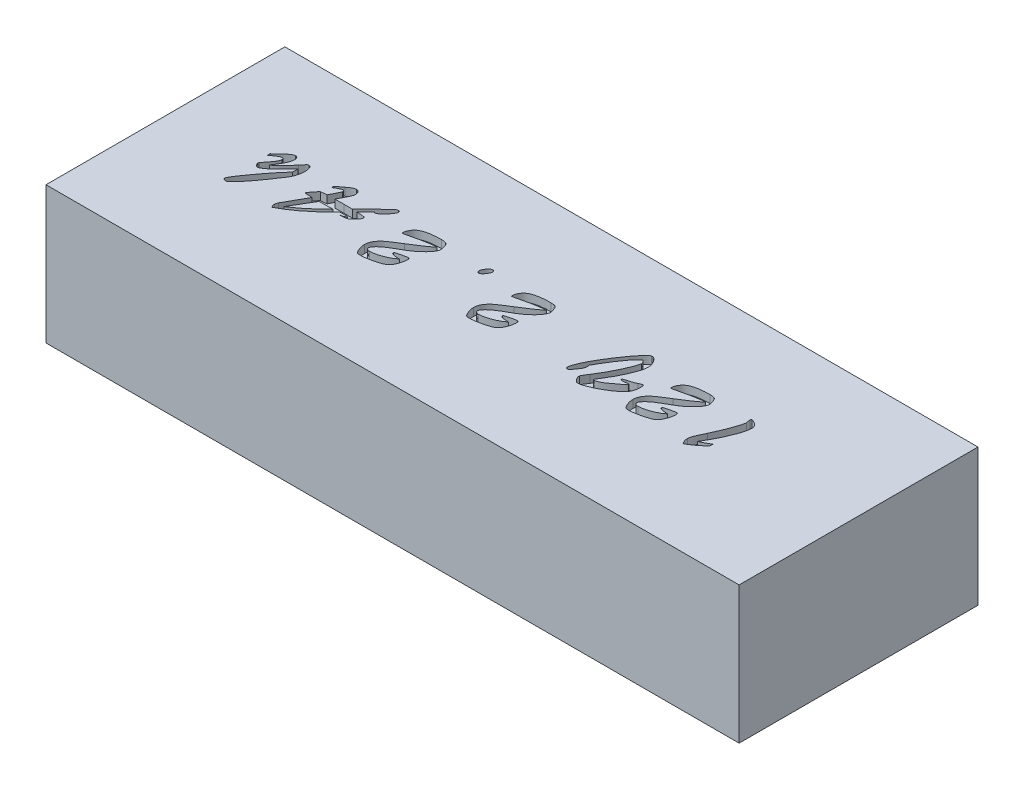
from build123d import *

# Parameters (mm, degrees)
SKETCH_15_W         = 177
SKETCH_15_H         = 35
EXTRUDE_1_DEPTH     = 61
CUT_EXTRUDE_1_DEPTH = 2


with BuildPart() as part:
    # 草图15 → 拉伸1 (new body)
    with BuildSketch(Plane.XY):
        Rectangle(SKETCH_15_W, SKETCH_15_H)
    extrude(amount=EXTRUDE_1_DEPTH)

    # 草图17 → 切除-拉伸1 (cut)
    # profile 1 of 8: a face of its own
    with BuildSketch(Plane(origin=(0, 17.5, 0), x_dir=(-1, 0, 0), z_dir=(0, 1, 0))):
        with BuildLine():
            Line((-54.027355029, 33.214724988), (-54.027355029, 34.105047569))
            add(Edge.make_bspline(
                [(-54.027355029, 34.105047569), (-53.849505071, 34.258497289), (-53.501007985, 34.559182095), (-52.978080495, 34.988064594), (-52.468469943, 35.388405433), (-51.972603012, 35.75987999), (-51.48890675, 36.099446051), (-51.015344563, 36.406167803), (-50.557627388, 36.687714872), (-50.250632295, 36.855719036), (-50.101548578, 36.937305634)],
                knots=[0, 0, 0, 0, 1.162118513, 2.277171826, 3.345656135, 4.368135439, 5.342192941, 6.268841697, 7.159310621, 8, 8, 8, 8], degree=3))
            add(Edge.make_bspline(
                [(-50.101548578, 36.937305634), (-50.012515981, 36.789926845), (-49.84260909, 36.508673993), (-49.662976636, 36.0726934), (-49.542027988, 35.654579686), (-49.527798138, 35.377843107), (-49.520903416, 35.243757247)],
                knots=[0, 0, 0, 0, 1.137868259, 2.171470516, 3.11403129, 4, 4, 4, 4], degree=3))
            add(Edge.make_bspline(
                [(-49.520903416, 35.243757247), (-49.522432163, 35.167272032), (-49.525634186, 35.00707062), (-49.565371778, 34.760680112), (-49.618556017, 34.49698058), (-49.688592109, 34.262433244), (-49.763992428, 34.043276629), (-49.849869671, 33.828397129), (-49.964049575, 33.564863251), (-50.100476312, 33.249340748), (-50.271513635, 32.887869879), (-50.463045217, 32.474583944), (-50.686894647, 32.014391993), (-50.844533349, 31.691054596), (-50.927355029, 31.521176601)],
                knots=[0, 0, 0, 0, 0.686216916, 1.437309403, 2.2365196, 3.101348091, 3.632713973, 4.317706836, 5.178645038, 6.212061466, 7.404462028, 8.769538373, 10.302750174, 12, 12, 12, 12], degree=3))
            add(Edge.make_bspline(
                [(-50.927355029, 31.521176601), (-51.121548909, 31.111688151), (-51.502339943, 30.308730147), (-52.01480083, 29.106687814), (-52.484259908, 27.94328985), (-52.820801114, 26.996163587), (-53.061094362, 26.284005263), (-53.210022809, 25.81169875), (-53.332077718, 25.397472013), (-53.430673824, 25.040915948), (-53.502914004, 24.740777134), (-53.548898557, 24.498035897), (-53.572110302, 24.310440779), (-53.560975985, 24.206109363), (-53.556387287, 24.163112085)],
                knots=[0, 0, 0, 0, 2.078851651, 4.076380107, 5.993559112, 7.833144257, 8.6864021, 9.441488966, 10.104852347, 10.667276435, 11.138686625, 11.519885961, 11.802134417, 12, 12, 12, 12], degree=3))
            add(Edge.make_bspline(
                [(-53.556387287, 24.163112085), (-53.533084238, 24.053567595), (-53.490467016, 23.853229784), (-53.442544015, 23.57997424), (-53.409670376, 23.362796627), (-53.403973279, 23.236302979), (-53.401548578, 23.182466924)],
                knots=[0, 0, 0, 0, 1.351825022, 2.472252726, 3.349786424, 4, 4, 4, 4], degree=3))
            add(Edge.make_bspline(
                [(-53.401548578, 23.182466924), (-53.402324505, 23.139065645), (-53.403736725, 23.060073534), (-53.439027743, 22.957164762), (-53.49657571, 22.879035836), (-53.551567068, 22.857642724), (-53.578967933, 22.846983053)],
                knots=[0, 0, 0, 0, 1.264800636, 2.301989114, 3.153922197, 4, 4, 4, 4], degree=3))
            add(Edge.make_bspline(
                [(-53.578967933, 22.846983053), (-53.653718273, 22.85507716), (-53.822383181, 22.873340511), (-54.092727034, 22.972709952), (-54.40338945, 23.132249052), (-54.687880212, 23.297150227), (-54.918028106, 23.460920588), (-55.072810884, 23.602841707), (-55.20561791, 23.756749698), (-55.310606247, 23.925227317), (-55.397996099, 24.104785018), (-55.453534809, 24.299237277), (-55.490870685, 24.504702246), (-55.495799059, 24.645732369), (-55.498322771, 24.717950795)],
                knots=[0, 0, 0, 0, 0.923802181, 2.084445488, 3.518449097, 5.229548094, 6.130646126, 6.993424202, 7.811176285, 8.627209044, 9.433284533, 10.263289462, 11.110668715, 12, 12, 12, 12], degree=3))
            add(Edge.make_bspline(
                [(-55.498322771, 24.717950795), (-55.49364736, 24.844954846), (-55.483749625, 25.113819414), (-55.430160528, 25.537761712), (-55.336487416, 26.004323779), (-55.211483338, 26.514770536), (-55.04681658, 27.069052077), (-54.851719776, 27.668176258), (-54.613367256, 28.308592733), (-54.25516814, 29.227343603), (-53.745265946, 30.401540293), (-53.051428511, 31.805212873), (-52.290353889, 33.205440409), (-51.725398639, 34.116294971), (-51.440258255, 34.576015311)],
                knots=[0, 0, 0, 0, 0.425399936, 0.900561592, 1.428734165, 2.018172412, 2.659625668, 3.36440062, 4.127573485, 4.947279051, 6.666251017, 8.411703564, 10.188939347, 12, 12, 12, 12], degree=3))
            add(Edge.make_bspline(
                [(-51.440258255, 34.576015311), (-51.648828171, 34.487973564), (-52.075423087, 34.307898879), (-52.712918252, 33.986149362), (-53.369663505, 33.624688311), (-53.804929892, 33.353370759), (-54.027355029, 33.214724988)],
                knots=[0, 0, 0, 0, 0.927840517, 1.897742753, 2.925727165, 4, 4, 4, 4], degree=3))
        make_face()
    # profile 2 of 8: a face of its own
    with BuildSketch(Plane(origin=(0, 17.5, 0), x_dir=(-1, 0, 0), z_dir=(0, 1, 0))):
        with BuildLine():
            add(Edge.make_bspline(
                [(-41.549935674, 32.298595956), (-41.383256519, 32.292837916), (-41.072263982, 32.282094475), (-40.640167156, 32.25709267), (-40.276658243, 32.209993115), (-39.978330321, 32.160777794), (-39.742990882, 32.089270605), (-39.569524581, 31.994905263), (-39.452457631, 31.865489355), (-39.439894089, 31.761759625), (-39.433806642, 31.711499182)],
                knots=[0, 0, 0, 0, 1.712128158, 3.194515118, 4.440360501, 5.473021791, 6.2967938, 6.949887491, 7.491186178, 8, 8, 8, 8], degree=3))
            add(Edge.make_bspline(
                [(-39.433806642, 31.711499182), (-39.437450279, 31.687229493), (-39.444946323, 31.637299519), (-39.493402323, 31.568079797), (-39.569407057, 31.508028089), (-39.657159489, 31.465593986), (-39.751878918, 31.434528313), (-39.85374496, 31.401348398), (-39.984292858, 31.362036192), (-40.147298961, 31.326757767), (-40.336349295, 31.275387098), (-40.556514162, 31.22599757), (-40.804275126, 31.166303518), (-41.072635305, 31.108802094), (-41.339853715, 31.048338704), (-41.587255952, 30.997033423), (-41.804675705, 30.95503541), (-41.990845971, 30.920458126), (-42.146232617, 30.889229021), (-42.272437089, 30.871459874), (-42.36785444, 30.85592558), (-42.421945669, 30.854144048), (-42.443484062, 30.853434666)],
                knots=[0, 0, 0, 0, 0.454144975, 0.934311362, 1.534835716, 2.25501497, 2.745203301, 3.40088538, 4.260823213, 5.295885172, 6.521314667, 7.927509613, 9.519277857, 11.292170825, 13.065063794, 14.648153313, 16.021990805, 17.210320673, 18.193380193, 18.987671717, 19.596904632, 20, 20, 20, 20], degree=3))
            add(Edge.make_bspline(
                [(-42.443484062, 30.853434666), (-42.49805028, 30.858975844), (-42.606685418, 30.8700077), (-42.725051578, 31.008128411), (-42.790940739, 31.202118443), (-42.795633266, 31.353670129), (-42.798322771, 31.44053144)],
                knots=[0, 0, 0, 0, 0.827101758, 1.646665563, 2.651194709, 4, 4, 4, 4], degree=3))
            add(Edge.make_bspline(
                [(-42.798322771, 31.44053144), (-42.795327725, 31.530944956), (-42.788997398, 31.722042835), (-42.751539335, 32.020466479), (-42.69210176, 32.34533903), (-42.585883029, 32.810985709), (-42.402638181, 33.393893914), (-42.162338146, 33.950831452), (-41.939238597, 34.356668832), (-41.766307951, 34.622419808), (-41.585526635, 34.847964349), (-41.384325992, 35.043256689), (-41.127509193, 35.209649907), (-40.803652223, 35.376072169), (-40.393292626, 35.541327706), (-39.730947105, 35.767533568), (-38.825807184, 36.025824814), (-37.891456327, 36.226452874), (-37.154493953, 36.350387752), (-36.644813275, 36.419887053), (-36.18287042, 36.460696668), (-35.890863674, 36.466722218), (-35.753161481, 36.469563698)],
                knots=[0, 0, 0, 0, 0.552948533, 1.168711237, 1.836805253, 2.572119188, 4.088157425, 5.566292137, 6.272636508, 6.918219531, 7.502531326, 8.037396291, 8.624623482, 9.36573545, 10.262000454, 11.326666401, 13.645136776, 16.012964412, 17.166357467, 18.214386186, 19.157954599, 20, 20, 20, 20], degree=3))
            add(Edge.make_bspline(
                [(-35.753161481, 36.469563698), (-35.673556577, 36.468525151), (-35.523756813, 36.466570822), (-35.316663127, 36.447490354), (-35.14159779, 36.419186927), (-35.012038685, 36.384592283), (-34.920804349, 36.329246602), (-34.849382436, 36.265745623), (-34.773596665, 36.178396657), (-34.69122091, 36.067087656), (-34.610402837, 35.92760861), (-34.51889219, 35.765871808), (-34.423164582, 35.579692017), (-34.290553209, 35.301965849), (-34.138980533, 34.937304487), (-34.011236062, 34.484769641), (-33.929099382, 34.028461585), (-33.919336424, 33.722595269), (-33.914451803, 33.569563698)],
                knots=[0, 0, 0, 0, 0.992300261, 1.867301351, 2.587913779, 3.206850752, 3.51949632, 3.909152152, 4.393389277, 4.959087463, 5.632658676, 6.400823473, 7.276132535, 8.241447597, 10.237783408, 12.189517989, 14.09353297, 16, 16, 16, 16], degree=3))
            add(Edge.make_bspline(
                [(-33.914451803, 33.569563698), (-33.921137022, 33.384959177), (-33.934226741, 33.023501869), (-34.059649656, 32.500168794), (-34.256166781, 32.008431781), (-34.539516612, 31.558751795), (-34.874945537, 31.141953244), (-35.242169218, 30.746473441), (-35.648325268, 30.38140862), (-36.015911209, 30.09734702), (-36.341079641, 29.875643364), (-36.612514889, 29.68818239), (-36.918229871, 29.489752485), (-37.248725336, 29.268198619), (-37.614091925, 29.03779805), (-38.008467532, 28.789665481), (-38.429655569, 28.520127094), (-38.723806461, 28.340015046), (-38.875742126, 28.246983053)],
                knots=[0, 0, 0, 0, 1.160088578, 2.271463839, 3.367318423, 4.47924987, 5.601696513, 6.731686741, 7.872045736, 9.034815783, 9.652440595, 10.348835808, 11.110893639, 11.946152371, 12.852921693, 13.829249471, 14.878757689, 16, 16, 16, 16], degree=3))
            add(Edge.make_bspline(
                [(-38.875742126, 28.246983053), (-39.060835978, 28.13216535), (-39.420854273, 27.908838249), (-39.941935515, 27.580193081), (-40.430616674, 27.270223766), (-40.884040148, 26.977202317), (-41.304905004, 26.702576602), (-41.692127156, 26.444655428), (-42.045683578, 26.203456106), (-42.366601454, 25.980444208), (-42.653811334, 25.774080863), (-42.907882751, 25.585117085), (-43.127376361, 25.412908398), (-43.317366575, 25.262457895), (-43.469402284, 25.124602771), (-43.592416526, 25.007746329), (-43.68165478, 24.907574037), (-43.72060702, 24.839995699), (-43.737032449, 24.811499182)],
                knots=[0, 0, 0, 0, 1.750353516, 3.404539268, 4.95068154, 6.400757937, 7.742882415, 8.989091186, 10.139500153, 11.182224826, 12.129458583, 12.981453384, 13.726427533, 14.371492799, 14.928345206, 15.374420061, 15.736204676, 16, 16, 16, 16], degree=3))
            add(Edge.make_bspline(
                [(-43.737032449, 24.811499182), (-43.645575974, 24.819548972), (-43.454864904, 24.836334924), (-43.157327934, 24.873915852), (-42.834413132, 24.914546397), (-42.488403434, 24.966954327), (-42.118597798, 25.025573764), (-41.724747473, 25.089448232), (-41.3064015, 25.163504197), (-40.727131357, 25.274873086), (-40.014712644, 25.412726691), (-39.198879506, 25.57830088), (-38.448237656, 25.748513724), (-37.864816969, 25.88163754), (-37.44506522, 25.989900774), (-37.175187852, 26.052272421), (-36.948184733, 26.112022704), (-36.760657245, 26.156576975), (-36.614281205, 26.191335722), (-36.508730974, 26.22024438), (-36.440965352, 26.230255023), (-36.410131604, 26.238293744), (-36.401548578, 26.24053144)],
                knots=[0, 0, 0, 0, 0.736432149, 1.53565688, 2.405493902, 3.347246641, 4.342768675, 5.409161659, 6.547928989, 7.750754798, 10.14109426, 12.369036871, 14.428288999, 16.315523824, 17.169084633, 17.905516782, 18.53732261, 19.051986577, 19.451575668, 19.744471653, 19.928869933, 20, 20, 20, 20], degree=3))
            add(Edge.make_bspline(
                [(-36.401548578, 26.24053144), (-36.370133502, 26.238688114), (-36.311283334, 26.235234994), (-36.241969056, 26.172741062), (-36.20303456, 26.082175919), (-36.20001124, 26.011988105), (-36.198322771, 25.972789505)],
                knots=[0, 0, 0, 0, 0.963027709, 1.80404922, 2.773601983, 4, 4, 4, 4], degree=3))
            add(Edge.make_bspline(
                [(-36.198322771, 25.972789505), (-36.205536897, 25.852672971), (-36.220693194, 25.6003178), (-36.341808519, 25.215501892), (-36.524235864, 24.80750768), (-36.730795068, 24.460212663), (-36.93433353, 24.179726793), (-37.123941595, 23.97968597), (-37.340163984, 23.791323288), (-37.588564131, 23.622299935), (-37.859138057, 23.458960765), (-38.160785416, 23.314227165), (-38.492104977, 23.187093564), (-38.848629467, 23.066697618), (-39.234832291, 22.964647141), (-39.648194513, 22.874787905), (-40.089235507, 22.796781834), (-40.560028897, 22.738202807), (-41.057556596, 22.683348705), (-41.58415108, 22.655766302), (-42.137853109, 22.629697001), (-42.516564369, 22.628330573), (-42.711225997, 22.627628214)],
                knots=[0, 0, 0, 0, 0.887452329, 1.86446592, 2.961484132, 4.192238212, 4.846236926, 5.521708883, 6.226755339, 6.963929466, 7.741675859, 8.56366018, 9.435351915, 10.366248975, 11.346658074, 12.389119003, 13.495702787, 14.659198309, 15.898945746, 17.198227383, 18.559858979, 20, 20, 20, 20], degree=3))
            add(Edge.make_bspline(
                [(-42.711225997, 22.627628214), (-42.820962188, 22.629351757), (-43.031175936, 22.632653424), (-43.332221104, 22.661153728), (-43.602916245, 22.709939443), (-43.85166677, 22.772201902), (-44.082732978, 22.895962602), (-44.266906019, 23.118121065), (-44.437649158, 23.407885231), (-44.565456384, 23.761296262), (-44.675389772, 24.11566443), (-44.753323682, 24.425509927), (-44.813396092, 24.663106486), (-44.823308112, 24.800546104), (-44.827355029, 24.856660472)],
                knots=[0, 0, 0, 0, 1.118255224, 2.142161307, 3.077240767, 3.920194592, 4.749359182, 5.695863099, 6.815996076, 8.169276886, 9.510748153, 10.597855967, 11.427527315, 12, 12, 12, 12], degree=3))
            add(Edge.make_bspline(
                [(-44.827355029, 24.856660472), (-44.82026855, 24.948766738), (-44.804750352, 25.150463965), (-44.693474035, 25.462650913), (-44.530175056, 25.811746916), (-44.299185564, 26.191246528), (-44.010537856, 26.599439913), (-43.656183483, 27.021722328), (-43.241614779, 27.455875857), (-42.773310157, 27.901667078), (-42.256048316, 28.34638132), (-41.694548291, 28.77441103), (-41.094852938, 29.183859625), (-40.673887633, 29.435185371), (-40.459613094, 29.563112085)],
                knots=[0, 0, 0, 0, 0.501938061, 1.099159917, 1.791816318, 2.604496272, 3.517377043, 4.516823598, 5.607864017, 6.790108059, 8.041986043, 9.326410419, 10.639122589, 12, 12, 12, 12], degree=3))
            Line((-40.459613094, 29.563112085), (-38.140258255, 30.901821763))
            add(Edge.make_bspline(
                [(-38.140258255, 30.901821763), (-38.058479816, 30.954419911), (-37.903453719, 31.054129392), (-37.683839919, 31.197332876), (-37.485886788, 31.322382365), (-37.312885899, 31.436064223), (-37.161435912, 31.531418581), (-37.035626525, 31.613739234), (-36.931632437, 31.676475234), (-36.82262989, 31.750633041), (-36.684488198, 31.841934858), (-36.517807029, 31.989183963), (-36.313873512, 32.15758158), (-36.100092769, 32.361599027), (-35.880040135, 32.569674613), (-35.688251267, 32.779418309), (-35.523707348, 32.973859394), (-35.391301611, 33.157383897), (-35.286838009, 33.328495616), (-35.210011105, 33.486324094), (-35.16602651, 33.632876357), (-35.157230167, 33.72633504), (-35.153161481, 33.769563698)],
                knots=[0, 0, 0, 0, 1.373843532, 2.604373499, 3.704363615, 4.682034968, 5.529166087, 6.232975601, 6.806293195, 7.244523026, 8.095867063, 9.14241321, 10.381634986, 11.832933368, 13.315622035, 14.659569981, 15.846172298, 16.912924958, 17.853535158, 18.675918084, 19.387555192, 20, 20, 20, 20], degree=3))
            add(Edge.make_bspline(
                [(-35.153161481, 33.769563698), (-35.156537494, 33.822868863), (-35.162948861, 33.92410041), (-35.22187941, 34.064499958), (-35.318251364, 34.182220757), (-35.501966206, 34.292155075), (-35.758035632, 34.396366354), (-35.978864158, 34.410783535), (-36.088645352, 34.417950795)],
                knots=[0, 0, 0, 0, 0.753891082, 1.431710418, 2.125848706, 2.875551902, 4.446733096, 6, 6, 6, 6], degree=3))
            add(Edge.make_bspline(
                [(-36.088645352, 34.417950795), (-36.182242982, 34.415721616), (-36.375131901, 34.411127656), (-36.673486147, 34.384293562), (-36.987974122, 34.339484129), (-37.317824951, 34.273038638), (-37.6636338, 34.193068555), (-38.025093163, 34.092497127), (-38.401968108, 33.971909062), (-38.921523256, 33.794416302), (-39.557857015, 33.539877255), (-40.277477432, 33.175489455), (-40.946002621, 32.770043631), (-41.350604416, 32.454199723), (-41.549935674, 32.298595956)],
                knots=[0, 0, 0, 0, 0.566287438, 1.167022835, 1.811003258, 2.487167056, 3.201968158, 3.957942266, 4.756200255, 5.59554555, 7.279483931, 8.897013492, 10.471281612, 12, 12, 12, 12], degree=3))
        make_face()
    # profile 3 of 8: a face of its own
    with BuildSketch(Plane(origin=(0, 17.5, 0), x_dir=(-1, 0, 0), z_dir=(0, 1, 0))):
        with BuildLine():
            add(Edge.make_bspline(
                [(-20.749935674, 31.608273376), (-20.774933565, 31.695875759), (-20.824600854, 31.86992936), (-20.832906895, 32.050729342), (-20.837032449, 32.14053144)],
                knots=[0, 0, 0, 0, 1.006613858, 2, 2, 2, 2], degree=3))
            add(Edge.make_bspline(
                [(-20.837032449, 32.14053144), (-20.834727342, 32.209562637), (-20.830039397, 32.349952854), (-20.784443518, 32.563171278), (-20.713496929, 32.781205403), (-20.611877604, 33.011735509), (-20.476348925, 33.263519735), (-20.299735488, 33.547449659), (-20.083392553, 33.870173961), (-19.876461046, 34.155004203), (-19.707797942, 34.390127737), (-19.583272411, 34.546152952), (-19.477965348, 34.68744965), (-19.38142209, 34.804209323), (-19.300628664, 34.90383671), (-19.229702967, 34.980427732), (-19.172230161, 35.039336554), (-19.092253403, 35.108644189), (-18.973842102, 35.175657278), (-18.86157121, 35.189002407), (-18.808000191, 35.19537015)],
                knots=[0, 0, 0, 0, 0.979192667, 1.991405004, 3.08276252, 4.231678255, 5.563769359, 7.140364566, 8.978429314, 11.080161825, 12.139976486, 13.08684521, 13.914534804, 14.641910604, 15.238226685, 15.7353848, 16.124097833, 16.405664382, 17.239249076, 18, 18, 18, 18], degree=3))
            add(Edge.make_bspline(
                [(-18.808000191, 35.19537015), (-18.748124393, 35.191674421), (-18.635093135, 35.184697765), (-18.494000604, 35.077859624), (-18.417809004, 34.907402934), (-18.411534293, 34.777955937), (-18.408000191, 34.705047569)],
                knots=[0, 0, 0, 0, 0.981323321, 1.852504923, 2.790467412, 4, 4, 4, 4], degree=3))
            add(Edge.make_bspline(
                [(-18.408000191, 34.705047569), (-18.410780979, 34.633931586), (-18.416887383, 34.477766182), (-18.462728818, 34.226495004), (-18.535132155, 33.939632152), (-18.632783382, 33.615509949), (-18.758950536, 33.255088854), (-18.915231603, 32.859094758), (-19.096157568, 32.425298126), (-19.305412215, 31.957724625), (-19.539180111, 31.456743989), (-19.808995684, 30.932848074), (-20.101873846, 30.381892109), (-20.420413804, 29.805817984), (-20.775633583, 29.21014199), (-21.150441318, 28.584201603), (-21.557550786, 27.936067708), (-21.987344341, 27.276607154), (-22.419540126, 26.621707644), (-22.840149851, 25.993444446), (-23.247132689, 25.405544769), (-23.638596642, 24.857616548), (-24.008318517, 24.344074418), (-24.361629131, 23.869633279), (-24.702695495, 23.437808779), (-25.018503299, 23.041272937), (-25.318460946, 22.689292492), (-25.59755832, 22.383084283), (-25.855092671, 22.123815978), (-26.091094794, 21.911516789), (-26.306684125, 21.745638613), (-26.499417825, 21.624338399), (-26.672910134, 21.543584929), (-26.785866225, 21.532602826), (-26.837032449, 21.527628214)],
                knots=[0, 0, 0, 0, 0.428542105, 0.941046549, 1.535232365, 2.211886391, 2.980526937, 3.836262313, 4.777528164, 5.813319729, 6.923739195, 8.109244249, 9.364685548, 10.684761649, 12.076418444, 13.54472893, 15.082242263, 16.689376438, 18.289214917, 19.811752002, 21.246420167, 22.598812254, 23.870608752, 25.060552293, 26.163894177, 27.187221478, 28.115862568, 28.950752001, 29.684012696, 30.317511851, 30.86324023, 31.320105263, 31.692025052, 32, 32, 32, 32], degree=3))
            add(Edge.make_bspline(
                [(-26.837032449, 21.527628214), (-26.891086248, 21.531122277), (-27.002030812, 21.538293787), (-27.166550813, 21.585774796), (-27.330741203, 21.660320998), (-27.48929118, 21.771462007), (-27.651763821, 21.906901134), (-27.811833864, 22.075434285), (-27.969621271, 22.274193025), (-28.178769108, 22.573148231), (-28.408246177, 22.977066915), (-28.605239155, 23.491554532), (-28.732200466, 24.020409276), (-28.746156919, 24.379608749), (-28.753161481, 24.559886279)],
                knots=[0, 0, 0, 0, 0.503812945, 1.034068056, 1.585876405, 2.178189513, 2.832896881, 3.556178244, 4.340664417, 5.197366464, 6.957109426, 8.655220357, 10.32129873, 12, 12, 12, 12], degree=3))
            add(Edge.make_bspline(
                [(-28.753161481, 24.559886279), (-28.749441785, 24.663240002), (-28.741546502, 24.882614667), (-28.693241312, 25.229750051), (-28.614906315, 25.614099742), (-28.50353196, 26.035401754), (-28.364576764, 26.495149592), (-28.1917204, 26.991200085), (-27.991844481, 27.527305401), (-27.761764055, 28.096859675), (-27.500788431, 28.688254211), (-27.220811765, 29.29729265), (-26.913944189, 29.913447801), (-26.587777482, 30.54252134), (-26.236199338, 31.178107853), (-25.864496693, 31.826389851), (-25.467859635, 32.482336386), (-25.192478249, 32.921554626), (-25.053161481, 33.143757247)],
                knots=[0, 0, 0, 0, 0.526360192, 1.117232038, 1.781935733, 2.522991214, 3.335378594, 4.227145286, 5.19740584, 6.248758313, 7.354564737, 8.488838769, 9.661784308, 10.859367023, 12.096938382, 13.360165343, 14.664494947, 16, 16, 16, 16], degree=3))
            add(Edge.make_bspline(
                [(-25.053161481, 33.143757247), (-25.008740749, 33.210203276), (-24.924854971, 33.335682453), (-24.811975492, 33.51537866), (-24.71962047, 33.675463373), (-24.636878042, 33.809533508), (-24.575364338, 33.924864125), (-24.533790171, 34.019070668), (-24.504848711, 34.089601921), (-24.497859248, 34.13072925), (-24.495096965, 34.146983053)],
                knots=[0, 0, 0, 0, 1.663907011, 3.142184467, 4.416771264, 5.510906452, 6.422128385, 7.133544335, 7.657570762, 8, 8, 8, 8], degree=3))
            add(Edge.make_bspline(
                [(-24.495096965, 34.146983053), (-24.497430672, 34.164188107), (-24.502324362, 34.200266402), (-24.555047259, 34.237669943), (-24.627648999, 34.258210239), (-24.685151123, 34.259280742), (-24.71767761, 34.259886279)],
                knots=[0, 0, 0, 0, 0.724523522, 1.51929627, 2.596772189, 4, 4, 4, 4], degree=3))
            add(Edge.make_bspline(
                [(-24.71767761, 34.259886279), (-24.806268992, 34.254019785), (-24.996830478, 34.241400864), (-25.298333108, 34.15883397), (-25.635618044, 34.033781766), (-25.93643027, 33.884418338), (-26.203785265, 33.745353569), (-26.425941408, 33.60945456), (-26.6715176, 33.460741862), (-26.932131459, 33.283140841), (-27.216867381, 33.091329343), (-27.518356804, 32.875189554), (-27.839409136, 32.637979731), (-28.170570198, 32.388442126), (-28.491859239, 32.1391181), (-28.791127144, 31.915774639), (-29.046837261, 31.710299283), (-29.27239127, 31.5376856), (-29.456613888, 31.384671439), (-29.611091532, 31.264619591), (-29.722371992, 31.163540421), (-29.822719176, 31.073667958), (-29.907674266, 30.984960366), (-29.981893831, 30.899881748), (-30.028569578, 30.835241022), (-30.041823723, 30.796681796), (-30.046709868, 30.782466924)],
                knots=[0, 0, 0, 0, 0.987500039, 2.124128434, 3.466642505, 4.994535316, 5.863152793, 6.8251561, 7.896191104, 9.06300514, 10.339588895, 11.72315468, 13.197454012, 14.78917246, 16.345016846, 17.730605882, 18.951097053, 20.001272777, 20.896041359, 21.620462375, 22.180853544, 22.571082182, 23.122036959, 23.547152053, 23.83305744, 24, 24, 24, 24], degree=3))
            add(Edge.make_bspline(
                [(-30.046709868, 30.782466924), (-30.044591286, 30.762191503), (-30.040439981, 30.722462367), (-29.994436826, 30.67671875), (-29.926641888, 30.6507268), (-29.873921626, 30.648353345), (-29.843484062, 30.646983053)],
                knots=[0, 0, 0, 0, 0.868675548, 1.70214619, 2.673354977, 4, 4, 4, 4], degree=3))
            add(Edge.make_bspline(
                [(-29.843484062, 30.646983053), (-29.830565592, 30.647921178), (-29.793826642, 30.650589118), (-29.722154372, 30.66240447), (-29.616380268, 30.673200695), (-29.534831713, 30.685294704), (-29.488645352, 30.692144343)],
                knots=[0, 0, 0, 0, 0.434309597, 1.235136924, 2.434074479, 4, 4, 4, 4], degree=3))
            add(Edge.make_bspline(
                [(-29.488645352, 30.692144343), (-29.372527085, 30.70513793), (-29.161882107, 30.728709018), (-28.877167295, 30.759347266), (-28.655493898, 30.776135225), (-28.528444731, 30.780610491), (-28.475742126, 30.782466924)],
                knots=[0, 0, 0, 0, 1.378356949, 2.500415968, 3.37794173, 4, 4, 4, 4], degree=3))
            add(Edge.make_bspline(
                [(-28.475742126, 30.782466924), (-28.406496585, 30.780559898), (-28.285915344, 30.777239085), (-28.132657107, 30.744272506), (-28.021191315, 30.675769561), (-28.007706107, 30.605071293), (-28.001548578, 30.572789505)],
                knots=[0, 0, 0, 0, 1.456761013, 2.536741669, 3.331856403, 4, 4, 4, 4], degree=3))
            add(Edge.make_bspline(
                [(-28.001548578, 30.572789505), (-28.00827059, 30.540034817), (-28.023603597, 30.465320904), (-28.111272955, 30.393749405), (-28.219861249, 30.337548315), (-28.359127283, 30.284936007), (-28.550154499, 30.225020701), (-28.694974273, 30.183206562), (-28.775742126, 30.159886279)],
                knots=[0, 0, 0, 0, 0.638861883, 1.45725314, 2.078550859, 3.051399703, 4.355527636, 6, 6, 6, 6], degree=3))
            add(Edge.make_bspline(
                [(-28.775742126, 30.159886279), (-28.93612726, 30.115317317), (-29.230578184, 30.033493199), (-29.630160157, 29.913626596), (-29.948884891, 29.814941957), (-30.273679761, 29.705925068), (-30.640586367, 29.54956655), (-30.922758363, 29.408792987), (-31.07251632, 29.334079827)],
                knots=[0, 0, 0, 0, 1.224786845, 2.248585069, 3.069349052, 3.679835758, 4.768612544, 6, 6, 6, 6], degree=3))
            add(Edge.make_bspline(
                [(-31.07251632, 29.334079827), (-31.131514735, 29.306880197), (-31.242573364, 29.255679608), (-31.401273041, 29.188256903), (-31.539268712, 29.131065406), (-31.654552764, 29.081663345), (-31.749543923, 29.045859896), (-31.82368159, 29.019921702), (-31.877341583, 29.002790376), (-31.906885631, 28.997355445), (-31.91767761, 28.99537015)],
                knots=[0, 0, 0, 0, 1.710105641, 3.219103224, 4.538594036, 5.642522965, 6.520461362, 7.209754339, 7.711335633, 8, 8, 8, 8], degree=3))
            add(Edge.make_bspline(
                [(-31.91767761, 28.99537015), (-31.948495008, 28.997044521), (-32.008649696, 29.000312847), (-32.086896836, 29.050371751), (-32.144074718, 29.127272028), (-32.181990357, 29.231261825), (-32.198708259, 29.359700532), (-32.221438189, 29.509733803), (-32.228404709, 29.682419976), (-32.229830774, 29.805059465), (-32.230580836, 29.869563698)],
                knots=[0, 0, 0, 0, 0.713025674, 1.391805893, 2.092695986, 2.930690766, 3.954385578, 5.123834635, 6.487234069, 8, 8, 8, 8], degree=3))
            add(Edge.make_bspline(
                [(-32.230580836, 29.869563698), (-32.228220127, 29.987869779), (-32.223623258, 30.218240291), (-32.202524763, 30.554453858), (-32.161055393, 30.872535297), (-32.098172248, 31.172363816), (-32.025618799, 31.456391206), (-31.936184902, 31.722697233), (-31.824940598, 31.96887691), (-31.696832534, 32.203794529), (-31.541639428, 32.433949069), (-31.353178531, 32.666366789), (-31.127412477, 32.905022289), (-30.870633556, 33.156360908), (-30.575860678, 33.415117239), (-30.242510592, 33.677116884), (-29.87758112, 33.95243554), (-29.343520412, 34.330661543), (-28.639608201, 34.789116588), (-27.762546011, 35.298075781), (-26.866198311, 35.772324971), (-26.102263953, 36.121764631), (-25.501802635, 36.376587575), (-25.082268363, 36.539140327), (-24.698418755, 36.685718715), (-24.343707231, 36.795241908), (-24.024689164, 36.890201896), (-23.736229293, 36.949531179), (-23.481333188, 36.992986642), (-23.321049037, 36.999022401), (-23.246709868, 37.001821763)],
                knots=[0, 0, 0, 0, 0.806487762, 1.570426456, 2.294958489, 2.990632914, 3.657248026, 4.292294887, 4.902495893, 5.496188657, 6.11413092, 6.791734823, 7.533266988, 8.352147475, 9.240164846, 10.205060856, 11.241379917, 12.355770817, 14.665039822, 16.964109984, 19.265456945, 21.574028039, 22.687478637, 23.710941487, 24.640798379, 25.486811797, 26.240842575, 26.907820185, 27.493451233, 28, 28, 28, 28], degree=3))
            add(Edge.make_bspline(
                [(-23.246709868, 37.001821763), (-23.170204153, 36.993464859), (-23.009392262, 36.975898987), (-22.775785012, 36.850008735), (-22.551142728, 36.649686972), (-22.334986458, 36.388580764), (-22.14220934, 36.094725583), (-21.99181697, 35.789770924), (-21.903840835, 35.480873219), (-21.891493517, 35.274372604), (-21.885419545, 35.172789505)],
                knots=[0, 0, 0, 0, 0.747912381, 1.572081296, 2.542977149, 3.68638631, 4.881022272, 5.978506002, 7.00557378, 8, 8, 8, 8], degree=3))
            add(Edge.make_bspline(
                [(-21.885419545, 35.172789505), (-21.890214829, 35.151097797), (-21.903348293, 35.091687901), (-21.953642071, 34.985731275), (-22.030744941, 34.838965762), (-22.138451925, 34.650610196), (-22.278097065, 34.422806072), (-22.445431854, 34.150876509), (-22.645353438, 33.839651725), (-22.789561018, 33.61892153), (-22.866064707, 33.501821763)],
                knots=[0, 0, 0, 0, 0.27392287, 0.750228147, 1.43962827, 2.326294518, 3.429213065, 4.74189267, 6.271538644, 8, 8, 8, 8], degree=3))
            add(Edge.make_bspline(
                [(-22.866064707, 33.501821763), (-22.984323285, 33.325084455), (-23.225874198, 32.964086896), (-23.574649321, 32.399684336), (-23.927753712, 31.807351129), (-24.281677157, 31.187429372), (-24.63338734, 30.535643468), (-24.988875427, 29.857375088), (-25.338761521, 29.14563941), (-25.686677374, 28.423806486), (-26.01250906, 27.71987723), (-26.300354057, 27.065195744), (-26.543584988, 26.475133433), (-26.741020925, 25.94887756), (-26.897124003, 25.487573595), (-27.012694665, 25.092672758), (-27.08341668, 24.760201364), (-27.095965902, 24.559048861), (-27.101548578, 24.469563698)],
                knots=[0, 0, 0, 0, 1.017273948, 2.077848845, 3.173571432, 4.316332412, 5.492562599, 6.716629042, 7.979638052, 9.28651311, 10.550119112, 11.690341612, 12.707719607, 13.603013993, 14.378967246, 15.036819279, 15.571517221, 16, 16, 16, 16], degree=3))
            add(Edge.make_bspline(
                [(-27.101548578, 24.469563698), (-27.094782414, 24.387637662), (-27.080908956, 24.219655111), (-26.958758857, 23.981020497), (-26.772680762, 23.754367305), (-26.610906852, 23.625686519), (-26.524129223, 23.556660472)],
                knots=[0, 0, 0, 0, 0.873508939, 1.79105774, 2.815094654, 4, 4, 4, 4], degree=3))
            add(Edge.make_bspline(
                [(-26.524129223, 23.556660472), (-26.431740223, 23.624217857), (-26.238387301, 23.765602845), (-25.954396224, 24.014331452), (-25.658769887, 24.302095728), (-25.349110942, 24.627470801), (-25.030615244, 24.994057795), (-24.69684895, 25.39660895), (-24.35742188, 25.844530863), (-23.997989266, 26.32519677), (-23.635126613, 26.850679061), (-23.25627344, 27.412173795), (-22.867609749, 28.015512677), (-22.463754162, 28.656469758), (-22.05199177, 29.338543883), (-21.624631589, 30.057496616), (-21.19066878, 30.819288784), (-20.89901647, 31.341394284), (-20.749935674, 31.608273376)],
                knots=[0, 0, 0, 0, 0.550960415, 1.153057254, 1.815885832, 2.537440211, 3.315376053, 4.154083036, 5.055147655, 6.021417934, 7.04419899, 8.129953246, 9.283307218, 10.500192941, 11.77811532, 13.119986147, 14.527854084, 16, 16, 16, 16], degree=3))
        make_face()
    # profile 4 of 8: a face of its own
    with BuildSketch(Plane(origin=(0, 17.5, 0), x_dir=(-1, 0, 0), z_dir=(0, 1, 0))):
        with BuildLine():
            add(Edge.make_bspline(
                [(-0.878967933, 32.298595956), (-0.712288778, 32.292837916), (-0.40129624, 32.282094475), (0.030800586, 32.25709267), (0.394309498, 32.209993115), (0.692637421, 32.160777794), (0.92797686, 32.089270605), (1.101443161, 31.994905263), (1.218510111, 31.865489355), (1.231073653, 31.761759625), (1.2371611, 31.711499182)],
                knots=[0, 0, 0, 0, 1.712128158, 3.194515118, 4.440360501, 5.473021791, 6.2967938, 6.949887491, 7.491186178, 8, 8, 8, 8], degree=3))
            add(Edge.make_bspline(
                [(1.2371611, 31.711499182), (1.233517463, 31.687229493), (1.226021419, 31.637299519), (1.177565419, 31.568079797), (1.101560685, 31.508028089), (1.013808253, 31.465593986), (0.919088824, 31.434528313), (0.817222781, 31.401348398), (0.686674884, 31.362036192), (0.52366878, 31.326757767), (0.334618447, 31.275387098), (0.11445358, 31.22599757), (-0.133307384, 31.166303518), (-0.401667563, 31.108802094), (-0.668885973, 31.048338704), (-0.91628821, 30.997033423), (-1.133707963, 30.95503541), (-1.319878229, 30.920458126), (-1.475264875, 30.889229021), (-1.601469347, 30.871459874), (-1.696886698, 30.85592558), (-1.750977927, 30.854144048), (-1.77251632, 30.853434666)],
                knots=[0, 0, 0, 0, 0.454144975, 0.934311362, 1.534835716, 2.25501497, 2.745203301, 3.40088538, 4.260823213, 5.295885172, 6.521314667, 7.927509613, 9.519277857, 11.292170825, 13.065063794, 14.648153313, 16.021990805, 17.210320673, 18.193380193, 18.987671717, 19.596904632, 20, 20, 20, 20], degree=3))
            add(Edge.make_bspline(
                [(-1.77251632, 30.853434666), (-1.827082538, 30.858975844), (-1.935717676, 30.8700077), (-2.054083836, 31.008128411), (-2.119972997, 31.202118443), (-2.124665524, 31.353670129), (-2.127355029, 31.44053144)],
                knots=[0, 0, 0, 0, 0.827101758, 1.646665563, 2.651194709, 4, 4, 4, 4], degree=3))
            add(Edge.make_bspline(
                [(-2.127355029, 31.44053144), (-2.124359983, 31.530944956), (-2.118029656, 31.722042835), (-2.080571593, 32.020466479), (-2.021134018, 32.34533903), (-1.914915287, 32.810985709), (-1.731670439, 33.393893914), (-1.491370405, 33.950831452), (-1.268270855, 34.356668832), (-1.095340209, 34.622419808), (-0.914558893, 34.847964349), (-0.71335825, 35.043256689), (-0.456541451, 35.209649907), (-0.132684481, 35.376072169), (0.277675116, 35.541327706), (0.940020637, 35.767533568), (1.845160558, 36.025824814), (2.779511415, 36.226452874), (3.516473789, 36.350387752), (4.026154467, 36.419887053), (4.488097321, 36.460696668), (4.780104068, 36.466722218), (4.917806261, 36.469563698)],
                knots=[0, 0, 0, 0, 0.552948533, 1.168711237, 1.836805253, 2.572119188, 4.088157425, 5.566292137, 6.272636508, 6.918219531, 7.502531326, 8.037396291, 8.624623482, 9.36573545, 10.262000454, 11.326666401, 13.645136776, 16.012964412, 17.166357467, 18.214386186, 19.157954599, 20, 20, 20, 20], degree=3))
            add(Edge.make_bspline(
                [(4.917806261, 36.469563698), (4.997411165, 36.468525151), (5.147210929, 36.466570822), (5.354304615, 36.447490354), (5.529369952, 36.419186927), (5.658929057, 36.384592283), (5.750163393, 36.329246602), (5.821585306, 36.265745623), (5.897371076, 36.178396657), (5.979746832, 36.067087656), (6.060564905, 35.92760861), (6.152075552, 35.765871808), (6.24780316, 35.579692017), (6.380414533, 35.301965849), (6.531987209, 34.937304487), (6.65973168, 34.484769641), (6.74186836, 34.028461585), (6.751631318, 33.722595269), (6.756515938, 33.569563698)],
                knots=[0, 0, 0, 0, 0.992300261, 1.867301351, 2.587913779, 3.206850752, 3.51949632, 3.909152152, 4.393389277, 4.959087463, 5.632658676, 6.400823473, 7.276132535, 8.241447597, 10.237783408, 12.189517989, 14.09353297, 16, 16, 16, 16], degree=3))
            add(Edge.make_bspline(
                [(6.756515938, 33.569563698), (6.74983072, 33.384959177), (6.736741001, 33.023501869), (6.611318086, 32.500168794), (6.414800961, 32.008431781), (6.13145113, 31.558751795), (5.796022205, 31.141953244), (5.428798524, 30.746473441), (5.022642474, 30.38140862), (4.655056533, 30.09734702), (4.329888101, 29.875643364), (4.058452853, 29.68818239), (3.752737871, 29.489752485), (3.422242406, 29.268198619), (3.056875817, 29.03779805), (2.66250021, 28.789665481), (2.241312173, 28.520127094), (1.947161281, 28.340015046), (1.795225616, 28.246983053)],
                knots=[0, 0, 0, 0, 1.160088578, 2.271463839, 3.367318423, 4.47924987, 5.601696513, 6.731686741, 7.872045736, 9.034815783, 9.652440595, 10.348835808, 11.110893639, 11.946152371, 12.852921693, 13.829249471, 14.878757689, 16, 16, 16, 16], degree=3))
            add(Edge.make_bspline(
                [(1.795225616, 28.246983053), (1.610131764, 28.13216535), (1.250113469, 27.908838249), (0.729032227, 27.580193081), (0.240351068, 27.270223766), (-0.213072406, 26.977202317), (-0.633937262, 26.702576602), (-1.021159414, 26.444655428), (-1.374715836, 26.203456106), (-1.695633712, 25.980444208), (-1.982843592, 25.774080863), (-2.236915009, 25.585117085), (-2.456408619, 25.412908398), (-2.646398833, 25.262457895), (-2.798434542, 25.124602771), (-2.921448784, 25.007746329), (-3.010687038, 24.907574037), (-3.049639278, 24.839995699), (-3.066064707, 24.811499182)],
                knots=[0, 0, 0, 0, 1.750353516, 3.404539268, 4.95068154, 6.400757937, 7.742882415, 8.989091186, 10.139500153, 11.182224826, 12.129458583, 12.981453384, 13.726427533, 14.371492799, 14.928345206, 15.374420061, 15.736204676, 16, 16, 16, 16], degree=3))
            add(Edge.make_bspline(
                [(-3.066064707, 24.811499182), (-2.974608233, 24.819548972), (-2.783897162, 24.836334924), (-2.486360193, 24.873915852), (-2.16344539, 24.914546397), (-1.817435692, 24.966954327), (-1.447630056, 25.025573764), (-1.053779731, 25.089448232), (-0.635433758, 25.163504197), (-0.056163616, 25.274873086), (0.656255097, 25.412726691), (1.472088236, 25.57830088), (2.222730086, 25.748513724), (2.806150773, 25.88163754), (3.225902521, 25.989900774), (3.49577989, 26.052272421), (3.722783009, 26.112022704), (3.910310497, 26.156576975), (4.056686537, 26.191335722), (4.162236768, 26.22024438), (4.23000239, 26.230255023), (4.260836138, 26.238293744), (4.269419164, 26.24053144)],
                knots=[0, 0, 0, 0, 0.736432149, 1.53565688, 2.405493902, 3.347246641, 4.342768675, 5.409161659, 6.547928989, 7.750754798, 10.14109426, 12.369036871, 14.428288999, 16.315523824, 17.169084633, 17.905516782, 18.53732261, 19.051986577, 19.451575668, 19.744471653, 19.928869933, 20, 20, 20, 20], degree=3))
            add(Edge.make_bspline(
                [(4.269419164, 26.24053144), (4.30083424, 26.238688114), (4.359684408, 26.235234994), (4.428998686, 26.172741062), (4.467933182, 26.082175919), (4.470956502, 26.011988105), (4.472644971, 25.972789505)],
                knots=[0, 0, 0, 0, 0.963027709, 1.80404922, 2.773601983, 4, 4, 4, 4], degree=3))
            add(Edge.make_bspline(
                [(4.472644971, 25.972789505), (4.465430845, 25.852672971), (4.450274548, 25.6003178), (4.329159223, 25.215501892), (4.146731878, 24.80750768), (3.940172674, 24.460212663), (3.736634212, 24.179726793), (3.547026147, 23.97968597), (3.330803758, 23.791323288), (3.08240361, 23.622299935), (2.811829685, 23.458960765), (2.510182326, 23.314227165), (2.178862765, 23.187093564), (1.822338275, 23.066697618), (1.436135451, 22.964647141), (1.022773229, 22.874787905), (0.581732235, 22.796781834), (0.110938845, 22.738202807), (-0.386588854, 22.683348705), (-0.913183338, 22.655766302), (-1.466885367, 22.629697001), (-1.845596627, 22.628330573), (-2.040258255, 22.627628214)],
                knots=[0, 0, 0, 0, 0.887452329, 1.86446592, 2.961484132, 4.192238212, 4.846236926, 5.521708883, 6.226755339, 6.963929466, 7.741675859, 8.56366018, 9.435351915, 10.366248975, 11.346658074, 12.389119003, 13.495702787, 14.659198309, 15.898945746, 17.198227383, 18.559858979, 20, 20, 20, 20], degree=3))
            add(Edge.make_bspline(
                [(-2.040258255, 22.627628214), (-2.149994446, 22.629351757), (-2.360208194, 22.632653424), (-2.661253362, 22.661153728), (-2.931948503, 22.709939443), (-3.180699028, 22.772201902), (-3.411765236, 22.895962602), (-3.595938277, 23.118121065), (-3.766681416, 23.407885231), (-3.894488642, 23.761296262), (-4.00442203, 24.11566443), (-4.08235594, 24.425509927), (-4.142428351, 24.663106486), (-4.15234037, 24.800546104), (-4.156387287, 24.856660472)],
                knots=[0, 0, 0, 0, 1.118255224, 2.142161307, 3.077240767, 3.920194592, 4.749359182, 5.695863099, 6.815996076, 8.169276886, 9.510748153, 10.597855967, 11.427527315, 12, 12, 12, 12], degree=3))
            add(Edge.make_bspline(
                [(-4.156387287, 24.856660472), (-4.149300808, 24.948766738), (-4.13378261, 25.150463965), (-4.022506293, 25.462650913), (-3.859207314, 25.811746916), (-3.628217822, 26.191246528), (-3.339570114, 26.599439913), (-2.985215741, 27.021722328), (-2.570647037, 27.455875857), (-2.102342415, 27.901667078), (-1.585080574, 28.34638132), (-1.023580549, 28.77441103), (-0.423885196, 29.183859625), (-0.002919891, 29.435185371), (0.211354648, 29.563112085)],
                knots=[0, 0, 0, 0, 0.501938061, 1.099159917, 1.791816318, 2.604496272, 3.517377043, 4.516823598, 5.607864017, 6.790108059, 8.041986043, 9.326410419, 10.639122589, 12, 12, 12, 12], degree=3))
            Line((0.211354648, 29.563112085), (2.530709487, 30.901821763))
            add(Edge.make_bspline(
                [(2.530709487, 30.901821763), (2.612487926, 30.954419911), (2.767514023, 31.054129392), (2.987127823, 31.197332876), (3.185080954, 31.322382365), (3.358081843, 31.436064223), (3.50953183, 31.531418581), (3.635341217, 31.613739234), (3.739335305, 31.676475234), (3.848337852, 31.750633041), (3.986479544, 31.841934858), (4.153160713, 31.989183963), (4.35709423, 32.15758158), (4.570874973, 32.361599027), (4.790927607, 32.569674613), (4.982716475, 32.779418309), (5.147260394, 32.973859394), (5.279666131, 33.157383897), (5.384129733, 33.328495616), (5.460956637, 33.486324094), (5.504941232, 33.632876357), (5.513737575, 33.72633504), (5.517806261, 33.769563698)],
                knots=[0, 0, 0, 0, 1.373843532, 2.604373499, 3.704363615, 4.682034968, 5.529166087, 6.232975601, 6.806293195, 7.244523026, 8.095867063, 9.14241321, 10.381634986, 11.832933368, 13.315622035, 14.659569981, 15.846172298, 16.912924958, 17.853535158, 18.675918084, 19.387555192, 20, 20, 20, 20], degree=3))
            add(Edge.make_bspline(
                [(5.517806261, 33.769563698), (5.514430248, 33.822868863), (5.50801888, 33.92410041), (5.449088332, 34.064499958), (5.352716378, 34.182220757), (5.169001536, 34.292155075), (4.912932109, 34.396366354), (4.692103583, 34.410783535), (4.58232239, 34.417950795)],
                knots=[0, 0, 0, 0, 0.753891082, 1.431710418, 2.125848706, 2.875551902, 4.446733096, 6, 6, 6, 6], degree=3))
            add(Edge.make_bspline(
                [(4.58232239, 34.417950795), (4.48872476, 34.415721616), (4.295835841, 34.411127656), (3.997481595, 34.384293562), (3.68299362, 34.339484129), (3.353142791, 34.273038638), (3.007333941, 34.193068555), (2.645874579, 34.092497127), (2.268999634, 33.971909062), (1.749444486, 33.794416302), (1.113110727, 33.539877255), (0.39349031, 33.175489455), (-0.275034879, 32.770043631), (-0.679636674, 32.454199723), (-0.878967933, 32.298595956)],
                knots=[0, 0, 0, 0, 0.566287438, 1.167022835, 1.811003258, 2.487167056, 3.201968158, 3.957942266, 4.756200255, 5.59554555, 7.279483931, 8.897013492, 10.471281612, 12, 12, 12, 12], degree=3))
        make_face()
    # profile 5 of 8: a face of its own
    with BuildSketch(Plane(origin=(0, 17.5, 0), x_dir=(-1, 0, 0), z_dir=(0, 1, 0))):
        with BuildLine():
            add(Edge.make_bspline(
                [(14.185548197, 24.717950795), (14.177647713, 24.624683328), (14.160785083, 24.425615172), (14.046590294, 24.120917967), (13.870592819, 23.794842292), (13.633320094, 23.468152314), (13.376830809, 23.167327956), (13.115025717, 22.937824125), (12.858504756, 22.789172957), (12.682694223, 22.766916631), (12.601677229, 22.756660472)],
                knots=[0, 0, 0, 0, 0.836036182, 1.784418376, 2.888802252, 4.1543613, 5.398019811, 6.424060003, 7.273775479, 8, 8, 8, 8], degree=3))
            add(Edge.make_bspline(
                [(12.601677229, 22.756660472), (12.543873195, 22.763487069), (12.424730999, 22.777557638), (12.27640244, 22.898981674), (12.170047004, 23.075623281), (12.161192567, 23.217309992), (12.156515938, 23.292144343)],
                knots=[0, 0, 0, 0, 0.887017935, 1.82826798, 2.852961171, 4, 4, 4, 4], degree=3))
            add(Edge.make_bspline(
                [(12.156515938, 23.292144343), (12.163482716, 23.374726172), (12.178959725, 23.5581854), (12.298391667, 23.843206895), (12.460181918, 24.174255928), (12.688032284, 24.518807917), (12.931805866, 24.849089839), (13.19231916, 25.098316316), (13.451321851, 25.265647982), (13.63315166, 25.288129312), (13.717806261, 25.298595956)],
                knots=[0, 0, 0, 0, 0.735930139, 1.634901727, 2.729742276, 4.02936617, 5.315981915, 6.382333645, 7.246862207, 8, 8, 8, 8], degree=3))
            add(Edge.make_bspline(
                [(13.717806261, 25.298595956), (13.787572298, 25.293520188), (13.919738974, 25.283904515), (14.086750296, 25.159352671), (14.175022963, 24.956802676), (14.181764718, 24.803810263), (14.185548197, 24.717950795)],
                knots=[0, 0, 0, 0, 0.973282803, 1.843813406, 2.789946307, 4, 4, 4, 4], degree=3))
        make_face()
    # profile 6 of 8: a face of its own
    with BuildSketch(Plane(origin=(0, 17.5, 0), x_dir=(-1, 0, 0), z_dir=(0, 1, 0))):
        with BuildLine():
            add(Edge.make_bspline(
                [(26.991999809, 32.298595956), (27.158678964, 32.292837916), (27.469671502, 32.282094475), (27.901768328, 32.25709267), (28.26527724, 32.209993115), (28.563605163, 32.160777794), (28.798944602, 32.089270605), (28.972410903, 31.994905263), (29.089477853, 31.865489355), (29.102041395, 31.761759625), (29.108128842, 31.711499182)],
                knots=[0, 0, 0, 0, 1.712128158, 3.194515118, 4.440360501, 5.473021791, 6.2967938, 6.949887491, 7.491186178, 8, 8, 8, 8], degree=3))
            add(Edge.make_bspline(
                [(29.108128842, 31.711499182), (29.104485205, 31.687229493), (29.096989161, 31.637299519), (29.048533161, 31.568079797), (28.972528427, 31.508028089), (28.884775995, 31.465593986), (28.790056566, 31.434528313), (28.688190523, 31.401348398), (28.557642626, 31.362036192), (28.394636522, 31.326757767), (28.205586189, 31.275387098), (27.985421322, 31.22599757), (27.737660358, 31.166303518), (27.469300179, 31.108802094), (27.202081769, 31.048338704), (26.954679531, 30.997033423), (26.737259779, 30.95503541), (26.551089513, 30.920458126), (26.395702867, 30.889229021), (26.269498395, 30.871459874), (26.174081044, 30.85592558), (26.119989815, 30.854144048), (26.098451422, 30.853434666)],
                knots=[0, 0, 0, 0, 0.454144975, 0.934311362, 1.534835716, 2.25501497, 2.745203301, 3.40088538, 4.260823213, 5.295885172, 6.521314667, 7.927509613, 9.519277857, 11.292170825, 13.065063794, 14.648153313, 16.021990805, 17.210320673, 18.193380193, 18.987671717, 19.596904632, 20, 20, 20, 20], degree=3))
            add(Edge.make_bspline(
                [(26.098451422, 30.853434666), (26.043885204, 30.858975844), (25.935250066, 30.8700077), (25.816883906, 31.008128411), (25.750994745, 31.202118443), (25.746302218, 31.353670129), (25.743612713, 31.44053144)],
                knots=[0, 0, 0, 0, 0.827101758, 1.646665563, 2.651194709, 4, 4, 4, 4], degree=3))
            add(Edge.make_bspline(
                [(25.743612713, 31.44053144), (25.746607759, 31.530944956), (25.752938085, 31.722042835), (25.790396149, 32.020466479), (25.849833724, 32.34533903), (25.956052455, 32.810985709), (26.139297303, 33.393893914), (26.379597337, 33.950831452), (26.602696887, 34.356668832), (26.775627532, 34.622419808), (26.956408849, 34.847964349), (27.157609492, 35.043256689), (27.414426291, 35.209649907), (27.738283261, 35.376072169), (28.148642858, 35.541327706), (28.810988379, 35.767533568), (29.7161283, 36.025824814), (30.650479157, 36.226452874), (31.387441531, 36.350387752), (31.897122209, 36.419887053), (32.359065063, 36.460696668), (32.65107181, 36.466722218), (32.788774003, 36.469563698)],
                knots=[0, 0, 0, 0, 0.552948533, 1.168711237, 1.836805253, 2.572119188, 4.088157425, 5.566292137, 6.272636508, 6.918219531, 7.502531326, 8.037396291, 8.624623482, 9.36573545, 10.262000454, 11.326666401, 13.645136776, 16.012964412, 17.166357467, 18.214386186, 19.157954599, 20, 20, 20, 20], degree=3))
            add(Edge.make_bspline(
                [(32.788774003, 36.469563698), (32.868378907, 36.468525151), (33.018178671, 36.466570822), (33.225272356, 36.447490354), (33.400337694, 36.419186927), (33.529896799, 36.384592283), (33.621131135, 36.329246602), (33.692553048, 36.265745623), (33.768338818, 36.178396657), (33.850714574, 36.067087656), (33.931532647, 35.92760861), (34.023043294, 35.765871808), (34.118770902, 35.579692017), (34.251382275, 35.301965849), (34.402954951, 34.937304487), (34.530699422, 34.484769641), (34.612836102, 34.028461585), (34.62259906, 33.722595269), (34.62748368, 33.569563698)],
                knots=[0, 0, 0, 0, 0.992300261, 1.867301351, 2.587913779, 3.206850752, 3.51949632, 3.909152152, 4.393389277, 4.959087463, 5.632658676, 6.400823473, 7.276132535, 8.241447597, 10.237783408, 12.189517989, 14.09353297, 16, 16, 16, 16], degree=3))
            add(Edge.make_bspline(
                [(34.62748368, 33.569563698), (34.620798462, 33.384959177), (34.607708743, 33.023501869), (34.482285828, 32.500168794), (34.285768703, 32.008431781), (34.002418872, 31.558751795), (33.666989947, 31.141953244), (33.299766266, 30.746473441), (32.893610216, 30.38140862), (32.526024275, 30.09734702), (32.200855842, 29.875643364), (31.929420595, 29.68818239), (31.623705613, 29.489752485), (31.293210148, 29.268198619), (30.927843559, 29.03779805), (30.533467952, 28.789665481), (30.112279915, 28.520127094), (29.818129023, 28.340015046), (29.666193358, 28.246983053)],
                knots=[0, 0, 0, 0, 1.160088578, 2.271463839, 3.367318423, 4.47924987, 5.601696513, 6.731686741, 7.872045736, 9.034815783, 9.652440595, 10.348835808, 11.110893639, 11.946152371, 12.852921693, 13.829249471, 14.878757689, 16, 16, 16, 16], degree=3))
            add(Edge.make_bspline(
                [(29.666193358, 28.246983053), (29.481099506, 28.13216535), (29.121081211, 27.908838249), (28.599999969, 27.580193081), (28.11131881, 27.270223766), (27.657895336, 26.977202317), (27.23703048, 26.702576602), (26.849808328, 26.444655428), (26.496251906, 26.203456106), (26.17533403, 25.980444208), (25.88812415, 25.774080863), (25.634052733, 25.585117085), (25.414559123, 25.412908398), (25.224568909, 25.262457895), (25.0725332, 25.124602771), (24.949518958, 25.007746329), (24.860280704, 24.907574037), (24.821328464, 24.839995699), (24.804903035, 24.811499182)],
                knots=[0, 0, 0, 0, 1.750353516, 3.404539268, 4.95068154, 6.400757937, 7.742882415, 8.989091186, 10.139500153, 11.182224826, 12.129458583, 12.981453384, 13.726427533, 14.371492799, 14.928345206, 15.374420061, 15.736204676, 16, 16, 16, 16], degree=3))
            add(Edge.make_bspline(
                [(24.804903035, 24.811499182), (24.896359509, 24.819548972), (25.08707058, 24.836334924), (25.384607549, 24.873915852), (25.707522352, 24.914546397), (26.053532049, 24.966954327), (26.423337686, 25.025573764), (26.817188011, 25.089448232), (27.235533984, 25.163504197), (27.814804126, 25.274873086), (28.527222839, 25.412726691), (29.343055978, 25.57830088), (30.093697828, 25.748513724), (30.677118515, 25.88163754), (31.096870263, 25.989900774), (31.366747632, 26.052272421), (31.593750751, 26.112022704), (31.781278239, 26.156576975), (31.927654279, 26.191335722), (32.03320451, 26.22024438), (32.100970132, 26.230255023), (32.13180388, 26.238293744), (32.140386906, 26.24053144)],
                knots=[0, 0, 0, 0, 0.736432149, 1.53565688, 2.405493902, 3.347246641, 4.342768675, 5.409161659, 6.547928989, 7.750754798, 10.14109426, 12.369036871, 14.428288999, 16.315523824, 17.169084633, 17.905516782, 18.53732261, 19.051986577, 19.451575668, 19.744471653, 19.928869933, 20, 20, 20, 20], degree=3))
            add(Edge.make_bspline(
                [(32.140386906, 26.24053144), (32.171801982, 26.238688114), (32.23065215, 26.235234994), (32.299966428, 26.172741062), (32.338900924, 26.082175919), (32.341924244, 26.011988105), (32.343612713, 25.972789505)],
                knots=[0, 0, 0, 0, 0.963027709, 1.80404922, 2.773601983, 4, 4, 4, 4], degree=3))
            add(Edge.make_bspline(
                [(32.343612713, 25.972789505), (32.336398587, 25.852672971), (32.321242289, 25.6003178), (32.200126965, 25.215501892), (32.017699619, 24.80750768), (31.811140416, 24.460212663), (31.607601954, 24.179726793), (31.417993888, 23.97968597), (31.2017715, 23.791323288), (30.953371352, 23.622299935), (30.682797426, 23.458960765), (30.381150067, 23.314227165), (30.049830507, 23.187093564), (29.693306017, 23.066697618), (29.307103193, 22.964647141), (28.893740971, 22.874787905), (28.452699977, 22.796781834), (27.981906587, 22.738202807), (27.484378888, 22.683348705), (26.957784404, 22.655766302), (26.404082375, 22.629697001), (26.025371115, 22.628330573), (25.830709487, 22.627628214)],
                knots=[0, 0, 0, 0, 0.887452329, 1.86446592, 2.961484132, 4.192238212, 4.846236926, 5.521708883, 6.226755339, 6.963929466, 7.741675859, 8.56366018, 9.435351915, 10.366248975, 11.346658074, 12.389119003, 13.495702787, 14.659198309, 15.898945746, 17.198227383, 18.559858979, 20, 20, 20, 20], degree=3))
            add(Edge.make_bspline(
                [(25.830709487, 22.627628214), (25.720973296, 22.629351757), (25.510759548, 22.632653424), (25.20971438, 22.661153728), (24.939019239, 22.709939443), (24.690268714, 22.772201902), (24.459202506, 22.895962602), (24.275029465, 23.118121065), (24.104286326, 23.407885231), (23.9764791, 23.761296262), (23.866545711, 24.11566443), (23.788611802, 24.425509927), (23.728539391, 24.663106486), (23.718627372, 24.800546104), (23.714580455, 24.856660472)],
                knots=[0, 0, 0, 0, 1.118255224, 2.142161307, 3.077240767, 3.920194592, 4.749359182, 5.695863099, 6.815996076, 8.169276886, 9.510748153, 10.597855967, 11.427527315, 12, 12, 12, 12], degree=3))
            add(Edge.make_bspline(
                [(23.714580455, 24.856660472), (23.721666934, 24.948766738), (23.737185132, 25.150463965), (23.848461449, 25.462650913), (24.011760428, 25.811746916), (24.24274992, 26.191246528), (24.531397628, 26.599439913), (24.885752001, 27.021722328), (25.300320705, 27.455875857), (25.768625327, 27.901667078), (26.285887168, 28.34638132), (26.847387193, 28.77441103), (27.447082546, 29.183859625), (27.868047851, 29.435185371), (28.08232239, 29.563112085)],
                knots=[0, 0, 0, 0, 0.501938061, 1.099159917, 1.791816318, 2.604496272, 3.517377043, 4.516823598, 5.607864017, 6.790108059, 8.041986043, 9.326410419, 10.639122589, 12, 12, 12, 12], degree=3))
            Line((28.08232239, 29.563112085), (30.401677229, 30.901821763))
            add(Edge.make_bspline(
                [(30.401677229, 30.901821763), (30.483455668, 30.954419911), (30.638481765, 31.054129392), (30.858095565, 31.197332876), (31.056048696, 31.322382365), (31.229049584, 31.436064223), (31.380499572, 31.531418581), (31.506308959, 31.613739234), (31.610303047, 31.676475234), (31.719305594, 31.750633041), (31.857447285, 31.841934858), (32.024128455, 31.989183963), (32.228061972, 32.15758158), (32.441842715, 32.361599027), (32.661895349, 32.569674613), (32.853684216, 32.779418309), (33.018228136, 32.973859394), (33.150633873, 33.157383897), (33.255097475, 33.328495616), (33.331924379, 33.486324094), (33.375908974, 33.632876357), (33.384705316, 33.72633504), (33.388774003, 33.769563698)],
                knots=[0, 0, 0, 0, 1.373843532, 2.604373499, 3.704363615, 4.682034968, 5.529166087, 6.232975601, 6.806293195, 7.244523026, 8.095867063, 9.14241321, 10.381634986, 11.832933368, 13.315622035, 14.659569981, 15.846172298, 16.912924958, 17.853535158, 18.675918084, 19.387555192, 20, 20, 20, 20], degree=3))
            add(Edge.make_bspline(
                [(33.388774003, 33.769563698), (33.38539799, 33.822868863), (33.378986622, 33.92410041), (33.320056074, 34.064499958), (33.22368412, 34.182220757), (33.039969278, 34.292155075), (32.783899851, 34.396366354), (32.563071325, 34.410783535), (32.453290132, 34.417950795)],
                knots=[0, 0, 0, 0, 0.753891082, 1.431710418, 2.125848706, 2.875551902, 4.446733096, 6, 6, 6, 6], degree=3))
            add(Edge.make_bspline(
                [(32.453290132, 34.417950795), (32.359692502, 34.415721616), (32.166803583, 34.411127656), (31.868449337, 34.384293562), (31.553961362, 34.339484129), (31.224110533, 34.273038638), (30.878301683, 34.193068555), (30.516842321, 34.092497127), (30.139967376, 33.971909062), (29.620412228, 33.794416302), (28.984078469, 33.539877255), (28.264458052, 33.175489455), (27.595932863, 32.770043631), (27.191331068, 32.454199723), (26.991999809, 32.298595956)],
                knots=[0, 0, 0, 0, 0.566287438, 1.167022835, 1.811003258, 2.487167056, 3.201968158, 3.957942266, 4.756200255, 5.59554555, 7.279483931, 8.897013492, 10.471281612, 12, 12, 12, 12], degree=3))
        make_face()
    # profile 7 of 8: a face of its own
    with BuildSketch(Plane(origin=(0, 17.5, 0), x_dir=(-1, 0, 0), z_dir=(0, 1, 0))):
        with BuildLine():
            add(Edge.make_bspline(
                [(48.456515938, 27.282466924), (48.328562541, 27.280038086), (48.082344709, 27.275364327), (47.725329866, 27.273070448), (47.394149369, 27.269681416), (47.087697783, 27.26638746), (46.808124491, 27.263607262), (46.55437788, 27.259031271), (46.326407245, 27.260064746), (46.182322017, 27.259943352), (46.114580455, 27.259886279)],
                knots=[0, 0, 0, 0, 1.311401149, 2.523499613, 3.65847113, 4.705298177, 5.663981583, 6.5235047, 7.305826837, 8, 8, 8, 8], degree=3))
            add(Edge.make_bspline(
                [(46.114580455, 27.259886279), (45.971566535, 27.259412305), (45.660793179, 27.258382346), (45.157603088, 27.267587649), (44.579077063, 27.272264639), (44.168340245, 27.278926593), (43.950064326, 27.282466924)],
                knots=[0, 0, 0, 0, 0.79279196, 1.7227597, 2.789816983, 4, 4, 4, 4], degree=3))
            add(Edge.make_bspline(
                [(43.950064326, 27.282466924), (43.732957061, 27.061941163), (43.312081102, 26.634438235), (42.701324179, 26.017233799), (42.132478395, 25.44521789), (41.607091291, 24.918981389), (41.122656976, 24.439992557), (40.685706582, 24.001594351), (40.283462676, 23.616835806), (39.928644397, 23.269447352), (39.611509096, 22.963895386), (39.325743627, 22.699231764), (39.075554798, 22.467644815), (38.858915387, 22.270287733), (38.677111992, 22.107427751), (38.523534322, 21.986400308), (38.409128811, 21.893111034), (38.261128176, 21.796191918), (38.062471889, 21.709240596), (37.883203713, 21.693251749), (37.798451422, 21.68569273)],
                knots=[0, 0, 0, 0, 1.992845548, 3.86325526, 5.591653765, 7.187845412, 8.651845326, 9.97874987, 11.173605982, 12.236203181, 13.176495503, 14.00938365, 14.74441498, 15.371828698, 15.896852009, 16.315363385, 16.63116482, 16.846267632, 17.454552037, 18, 18, 18, 18], degree=3))
            add(Edge.make_bspline(
                [(37.798451422, 21.68569273), (37.738456682, 21.688623015), (37.630531574, 21.693894333), (37.48990438, 21.764325959), (37.405348116, 21.890962752), (37.398806542, 21.989704813), (37.395225616, 22.043757247)],
                knots=[0, 0, 0, 0, 1.164564817, 2.09494668, 2.957153962, 4, 4, 4, 4], degree=3))
            add(Edge.make_bspline(
                [(37.395225616, 22.043757247), (37.398680652, 22.097833328), (37.406206358, 22.215621012), (37.462917049, 22.399933783), (37.551867494, 22.604524831), (37.676655733, 22.829495369), (37.831514299, 23.077204434), (38.020004924, 23.347174458), (38.247490663, 23.634867432), (38.496329213, 23.939571874), (38.758213791, 24.231973446), (39.013493787, 24.496659103), (39.258385496, 24.719471018), (39.489289149, 24.903666427), (39.706429323, 25.050728395), (39.913473607, 25.149658109), (40.106954527, 25.21916369), (40.234503895, 25.227083623), (40.295225616, 25.230854021)],
                knots=[0, 0, 0, 0, 0.577308778, 1.257485056, 2.044954981, 2.960034968, 4.002488074, 5.16581813, 6.47575132, 7.920291645, 9.368619049, 10.668538318, 11.847869985, 12.902909, 13.823812315, 14.640815871, 15.352940736, 16, 16, 16, 16], degree=3))
            add(Edge.make_bspline(
                [(40.295225616, 25.230854021), (40.310325358, 25.228972573), (40.350804348, 25.223928838), (40.422597396, 25.204211021), (40.517859418, 25.165386127), (40.589810008, 25.137199158), (40.630709487, 25.121176601)],
                knots=[0, 0, 0, 0, 0.515283554, 1.381358564, 2.511463625, 4, 4, 4, 4], degree=3))
            Line((40.630709487, 25.121176601), (42.701677229, 27.327628214))
            add(Edge.make_bspline(
                [(42.701677229, 27.327628214), (42.574782286, 27.334934861), (42.335991398, 27.348684507), (41.998352359, 27.371447434), (41.703699662, 27.393692252), (41.450872193, 27.415384976), (41.24151679, 27.439729102), (41.074028443, 27.455632673), (40.949270731, 27.478821664), (40.841902095, 27.505066612), (40.745043034, 27.552848747), (40.664456216, 27.636264253), (40.616299301, 27.743645946), (40.610958463, 27.821738162), (40.608128842, 27.863112085)],
                knots=[0, 0, 0, 0, 1.968955603, 3.705180419, 5.242033707, 6.546484125, 7.635435163, 8.507334556, 9.15094191, 9.599439483, 10.217762912, 10.795011126, 11.361586603, 12, 12, 12, 12], degree=3))
            add(Edge.make_bspline(
                [(40.608128842, 27.863112085), (40.617556003, 27.931909418), (40.639344708, 28.090918557), (40.77354117, 28.336979911), (40.963386212, 28.630931619), (41.222669126, 28.951626869), (41.509049017, 29.270207144), (41.799032386, 29.552880329), (42.083209625, 29.772197438), (42.320209406, 29.920372291), (42.526620006, 30.005215607), (42.709834421, 30.057137517), (42.923493325, 30.107489161), (43.170008269, 30.139603823), (43.44747876, 30.168848572), (43.757278737, 30.191456015), (44.099417635, 30.204079619), (44.33822533, 30.204715444), (44.462967551, 30.205047569)],
                knots=[0, 0, 0, 0, 0.673888859, 1.557538383, 2.697130692, 4.103518869, 5.576551269, 6.884584344, 8.053164912, 9.080345947, 9.603310105, 10.228321357, 10.939516968, 11.746425831, 12.655025579, 13.666445804, 14.781057981, 16, 16, 16, 16], degree=3))
            add(Edge.make_bspline(
                [(44.462967551, 30.205047569), (44.345518231, 30.188187164), (44.125752057, 30.15663869), (43.82227445, 30.091728397), (43.56488217, 30.022293808), (43.352325575, 29.943888743), (43.185692834, 29.851747263), (43.065385387, 29.751174179), (42.981962408, 29.639871418), (42.973527343, 29.555713099), (42.969419164, 29.514724988)],
                knots=[0, 0, 0, 0, 1.629617592, 3.049271157, 4.26066834, 5.289421742, 6.156075946, 6.857864361, 7.443739105, 8, 8, 8, 8], degree=3))
            Line((42.969419164, 29.514724988), (43.72748368, 29.514724988))
            add(Edge.make_bspline(
                [(43.72748368, 29.514724988), (43.8629658, 29.512223801), (44.109185228, 29.507678248), (44.43827485, 29.506246639), (44.690286061, 29.513692422), (44.830752365, 29.528120218), (44.888774003, 29.534079827)],
                knots=[0, 0, 0, 0, 1.398990017, 2.542464798, 3.397944014, 4, 4, 4, 4], degree=3))
            add(Edge.make_bspline(
                [(44.888774003, 29.534079827), (45.136674752, 29.776516376), (45.621645225, 30.250797184), (46.339969309, 30.936867521), (47.031592039, 31.582925935), (47.693616084, 32.190142896), (48.334581197, 32.751202481), (48.945780083, 33.274896347), (49.533689144, 33.75453104), (50.275546767, 34.344172844), (51.198303916, 35.028096922), (52.329358271, 35.78238194), (53.474045348, 36.496374549), (54.26074313, 36.923952495), (54.653290132, 37.137305634)],
                knots=[0, 0, 0, 0, 1.004748612, 1.96559878, 2.878247185, 3.747215514, 4.568511847, 5.346489836, 6.079366157, 6.766949808, 8.092441078, 9.405983914, 10.705636066, 12, 12, 12, 12], degree=3))
            add(Edge.make_bspline(
                [(54.653290132, 37.137305634), (54.709038727, 37.062810387), (54.817414653, 36.917990749), (54.926581246, 36.672358662), (54.998788049, 36.418871038), (55.007156756, 36.24425233), (55.011354648, 36.156660472)],
                knots=[0, 0, 0, 0, 1.04634741, 2.034111719, 3.013875383, 4, 4, 4, 4], degree=3))
            add(Edge.make_bspline(
                [(55.011354648, 36.156660472), (55.008657702, 36.078061551), (55.003456095, 35.926467616), (54.96999047, 35.708565331), (54.904195339, 35.511200692), (54.841972453, 35.392492276), (54.811354648, 35.334079827)],
                knots=[0, 0, 0, 0, 1.101370502, 2.124216025, 3.076989333, 4, 4, 4, 4], degree=3))
            Line((54.811354648, 35.334079827), (51.733935293, 29.846983053))
            add(Edge.make_bspline(
                [(51.733935293, 29.846983053), (51.872652847, 29.847723899), (52.129676237, 29.849096579), (52.485540996, 29.840430021), (52.781346153, 29.835857122), (53.020051438, 29.825828902), (53.206441565, 29.815003694), (53.3458472, 29.796213166), (53.44263478, 29.786822786), (53.515618193, 29.757144685), (53.563011715, 29.682719574), (53.562983951, 29.617666001), (53.562967551, 29.579241118)],
                knots=[0, 0, 0, 0, 2.110812298, 3.911027244, 5.416768432, 6.612267358, 7.547245587, 8.255590369, 8.753248119, 9.024102077, 9.423571034, 10, 10, 10, 10], degree=3))
            add(Edge.make_bspline(
                [(53.562967551, 29.579241118), (53.55503148, 29.556341389), (53.531409005, 29.488178153), (53.44877955, 29.368850177), (53.328160918, 29.189881969), (53.150573878, 28.959366024), (52.929564466, 28.669078934), (52.658011974, 28.323407183), (52.334120198, 27.924256463), (52.102721261, 27.638407361), (51.979096584, 27.48569273)],
                knots=[0, 0, 0, 0, 0.220530397, 0.656429839, 1.312466256, 2.195678905, 3.308589149, 4.643546267, 6.206817562, 8, 8, 8, 8], degree=3))
            Line((51.979096584, 27.48569273), (50.372644971, 27.350208859))
            add(Edge.make_bspline(
                [(50.372644971, 27.350208859), (50.273262719, 27.164424971), (50.08586045, 26.814097606), (49.829107791, 26.31772791), (49.607567997, 25.886969213), (49.43176286, 25.516456817), (49.285052864, 25.21414881), (49.19229911, 24.969600589), (49.12035592, 24.79369598), (49.106873869, 24.692457079), (49.101677229, 24.653434666)],
                knots=[0, 0, 0, 0, 1.691921187, 3.190407391, 4.487933404, 5.580879932, 6.484902335, 7.182402577, 7.684858051, 8, 8, 8, 8], degree=3))
            add(Edge.make_bspline(
                [(49.101677229, 24.653434666), (49.105468715, 24.586475689), (49.112382288, 24.464379577), (49.208848247, 24.304955785), (49.374789915, 24.217584675), (49.500652643, 24.209477187), (49.569419164, 24.205047569)],
                knots=[0, 0, 0, 0, 1.077444504, 1.964662434, 2.887970354, 4, 4, 4, 4], degree=3))
            add(Edge.make_bspline(
                [(49.569419164, 24.205047569), (49.597593489, 24.209603537), (49.66986183, 24.221289789), (49.795671391, 24.272886366), (49.967522899, 24.345868799), (50.180670347, 24.454715802), (50.442225757, 24.585555556), (50.742058771, 24.756491589), (51.092160755, 24.947187083), (51.336492681, 25.090344495), (51.466193358, 25.166337892)],
                knots=[0, 0, 0, 0, 0.320426056, 0.821906455, 1.521123459, 2.424997825, 3.512928867, 4.813013783, 6.30822654, 8, 8, 8, 8], degree=3))
            Line((51.466193358, 25.166337892), (51.375870777, 24.58569273))
            Line((51.375870777, 24.58569273), (49.772644971, 23.359886279))
            add(Edge.make_bspline(
                [(49.772644971, 23.359886279), (49.650878948, 23.269469717), (49.425889222, 23.10240507), (49.103128992, 22.887877006), (48.835524189, 22.709199365), (48.602528219, 22.582910761), (48.399058315, 22.490737417), (48.209628696, 22.429378548), (48.029319194, 22.387343406), (47.910488372, 22.381873846), (47.853290132, 22.379241118)],
                knots=[0, 0, 0, 0, 1.663326747, 3.073364978, 4.251258161, 5.190757245, 5.977612372, 6.697521885, 7.373062858, 8, 8, 8, 8], degree=3))
            add(Edge.make_bspline(
                [(47.853290132, 22.379241118), (47.784925456, 22.383399606), (47.649017744, 22.391666604), (47.45454436, 22.464604326), (47.273284173, 22.576829442), (47.110387213, 22.731116564), (46.974527065, 22.922813677), (46.874622497, 23.142644917), (46.814558105, 23.389009121), (46.808215039, 23.560608837), (46.804903035, 23.650208859)],
                knots=[0, 0, 0, 0, 0.893981452, 1.777218621, 2.689153079, 3.676894004, 4.698295027, 5.752281728, 6.826363977, 8, 8, 8, 8], degree=3))
            add(Edge.make_bspline(
                [(46.804903035, 23.650208859), (46.809490684, 23.717148216), (46.81975896, 23.866974809), (46.883919018, 24.111212104), (46.986441511, 24.396076722), (47.095763781, 24.666221883), (47.214931712, 24.914554856), (47.321186028, 25.147402885), (47.4620148, 25.411428566), (47.611767887, 25.718368898), (47.796786434, 26.055843822), (47.994362187, 26.434034406), (48.217681857, 26.846563441), (48.374664435, 27.133077209), (48.456515938, 27.282466924)],
                knots=[0, 0, 0, 0, 0.601047284, 1.345290288, 2.254676072, 3.319069972, 3.957962853, 4.72627448, 5.615261585, 6.642304438, 7.79056312, 9.068239578, 10.471365413, 12, 12, 12, 12], degree=3))
        make_face()
        with BuildLine():
            Line((46.404903035, 29.759886279), (49.92748368, 29.824402408))
            add(Edge.make_bspline(
                [(49.92748368, 29.824402408), (50.488023177, 30.783781843), (51.594967767, 32.678349276), (52.748436249, 34.544953144), (53.317806261, 35.466337892)],
                knots=[0, 0, 0, 0, 1.012768844, 2, 2, 2, 2], degree=3))
            add(Edge.make_bspline(
                [(53.317806261, 35.466337892), (53.049813328, 35.294124805), (52.500697245, 34.941261113), (51.682675437, 34.360779592), (50.843871206, 33.729283138), (49.990318903, 33.040903608), (49.116735016, 32.300028231), (48.22617251, 31.503995859), (47.314574653, 30.656072279), (46.712047095, 30.062477018), (46.404903035, 29.759886279)],
                knots=[0, 0, 0, 0, 0.851128161, 1.743957039, 2.679496377, 3.656382619, 4.673621436, 5.739979932, 6.847933623, 8, 8, 8, 8], degree=3))
        make_face(mode=Mode.SUBTRACT)
    # profile 8 of 8: a face of its own
    with BuildSketch(Plane(origin=(0, 17.5, 0), x_dir=(-1, 0, 0), z_dir=(0, 1, 0))):
        with BuildLine():
            Line((66.753290132, 26.234079827), (66.753290132, 25.543757247))
            add(Edge.make_bspline(
                [(66.753290132, 25.543757247), (66.640361, 25.429808964), (66.42039124, 25.207854044), (66.100210297, 24.883848683), (65.788191079, 24.588392112), (65.495876683, 24.309575404), (65.215424631, 24.054339557), (64.947819719, 23.824353519), (64.69935404, 23.610737586), (64.460040374, 23.425803447), (64.238507327, 23.257721828), (64.03294686, 23.11020747), (63.83785607, 22.992348748), (63.661002125, 22.890040208), (63.496989852, 22.812035121), (63.346791227, 22.757247253), (63.212387032, 22.716934954), (63.125565711, 22.713214162), (63.085548197, 22.711499182)],
                knots=[0, 0, 0, 0, 1.640492308, 3.195443858, 4.657429118, 6.034110195, 7.32621786, 8.534336164, 9.642286881, 10.676066573, 11.62605162, 12.486278588, 13.261340441, 13.955517905, 14.575259251, 15.114471072, 15.59184373, 16, 16, 16, 16], degree=3))
            add(Edge.make_bspline(
                [(63.085548197, 22.711499182), (63.022945509, 22.714587731), (62.904506457, 22.720431007), (62.737182, 22.764336036), (62.598242082, 22.847819615), (62.485415203, 22.96165677), (62.396238141, 23.105807372), (62.332653085, 23.281166534), (62.299235182, 23.48874318), (62.294516673, 23.636115997), (62.291999809, 23.714724988)],
                knots=[0, 0, 0, 0, 1.029171752, 1.947106938, 2.811199263, 3.661252231, 4.558874317, 5.576901405, 6.707513761, 8, 8, 8, 8], degree=3))
            add(Edge.make_bspline(
                [(62.291999809, 23.714724988), (62.2993595, 23.850595737), (62.314804173, 24.13572718), (62.409782685, 24.576991512), (62.569977211, 25.046587522), (62.785318834, 25.555109685), (63.072414476, 26.108139737), (63.428843465, 26.715974512), (63.855957456, 27.385350339), (64.175215134, 27.843849827), (64.343612713, 28.08569273)],
                knots=[0, 0, 0, 0, 0.666745962, 1.399199166, 2.204901144, 3.09842629, 4.105794625, 5.25934269, 6.554396377, 8, 8, 8, 8], degree=3))
            add(Edge.make_bspline(
                [(64.343612713, 28.08569273), (64.230787483, 28.021729003), (63.997523973, 27.889485498), (63.655631814, 27.65204796), (63.311097226, 27.373443566), (63.020272778, 27.108251275), (62.76932377, 26.862083421), (62.551515823, 26.632509871), (62.303208323, 26.364671365), (62.024953566, 26.057837671), (61.718996662, 25.708034655), (61.381083216, 25.319941299), (61.015920811, 24.889426663), (60.764874745, 24.5880465), (60.633935293, 24.430854021)],
                knots=[0, 0, 0, 0, 0.891115191, 1.84235972, 2.856958938, 3.934812541, 4.546293838, 5.272897164, 6.109668097, 7.056769004, 8.119849626, 9.303914634, 10.593788202, 12, 12, 12, 12], degree=3))
            add(Edge.make_bspline(
                [(60.633935293, 24.430854021), (60.553395388, 24.335062018), (60.400198865, 24.152854183), (60.182036426, 23.896726425), (59.988964851, 23.67001689), (59.827713248, 23.469213113), (59.682656904, 23.302730224), (59.53745062, 23.187377976), (59.398496294, 23.10710543), (59.301428338, 23.096876958), (59.256515938, 23.092144343)],
                knots=[0, 0, 0, 0, 1.533254037, 2.91643239, 4.12245792, 5.180054511, 6.075092525, 6.815755831, 7.452061732, 8, 8, 8, 8], degree=3))
            add(Edge.make_bspline(
                [(59.256515938, 23.092144343), (59.186228062, 23.097685987), (59.04648644, 23.108703509), (58.858361743, 23.220699627), (58.696511756, 23.388923935), (58.579894126, 23.630408654), (58.483301352, 23.928672094), (58.415560225, 24.291778157), (58.374775686, 24.719147868), (58.37128404, 25.025367609), (58.369419164, 25.188918537)],
                knots=[0, 0, 0, 0, 0.66938934, 1.330834792, 2.047081356, 2.888384093, 3.878545616, 5.058050999, 6.428714991, 8, 8, 8, 8], degree=3))
            add(Edge.make_bspline(
                [(58.369419164, 25.188918537), (58.372738242, 25.327750755), (58.379367823, 25.605056528), (58.426144591, 26.017907907), (58.499939733, 26.427879133), (58.607102124, 26.832896063), (58.742728166, 27.235420514), (58.911083093, 27.631616284), (59.109848271, 28.024012294), (59.337146553, 28.415714933), (59.594156428, 28.810817077), (59.855744017, 29.229129049), (60.142533954, 29.661683948), (60.442900612, 30.113773039), (60.76212941, 30.583380432), (61.091784991, 31.074072342), (61.44531447, 31.579560543), (61.926589, 32.269997406), (62.526729867, 33.110025599), (63.242966282, 34.055164322), (63.924488727, 34.924704437), (64.484932888, 35.582244919), (64.903744877, 36.058438508), (65.188530816, 36.357854053), (65.442758928, 36.614762104), (65.670242086, 36.824218062), (65.870609174, 36.989362502), (66.044386791, 37.104628653), (66.189558261, 37.187108414), (66.283809793, 37.199660736), (66.324257874, 37.205047569)],
                knots=[0, 0, 0, 0, 0.791718176, 1.581390995, 2.366885306, 3.165673907, 3.968571832, 4.787540206, 5.618566793, 6.475857901, 7.369072828, 8.306500608, 9.289654467, 10.328915062, 11.402215572, 12.528255076, 13.700395821, 14.920257284, 17.328498195, 19.58781354, 21.683454351, 23.628501673, 24.514678061, 25.299885031, 25.985052943, 26.575391398, 27.063859843, 27.461874539, 27.769063254, 28, 28, 28, 28], degree=3))
            add(Edge.make_bspline(
                [(66.324257874, 37.205047569), (66.345794514, 37.203149903), (66.399919186, 37.198380796), (66.498971883, 37.180690778), (66.632948687, 37.150471071), (66.792655758, 37.116657552), (66.952039577, 37.071197074), (67.079363627, 36.993712563), (67.161485879, 36.885576215), (67.16890507, 36.802010484), (67.172644971, 36.759886279)],
                knots=[0, 0, 0, 0, 0.497408517, 1.250059098, 2.313028394, 3.657817735, 5.011684394, 6.103080344, 7.043791855, 8, 8, 8, 8], degree=3))
            add(Edge.make_bspline(
                [(67.172644971, 36.759886279), (67.170343195, 36.729627363), (67.165166595, 36.661576295), (67.132345452, 36.549158586), (67.07988079, 36.415242205), (67.009210663, 36.257790241), (66.916447482, 36.079331439), (66.808439571, 35.877265598), (66.677249532, 35.653040429), (66.527114099, 35.406485971), (66.353843362, 35.138023001), (66.165655541, 34.845212715), (65.954325587, 34.532302281), (65.725967883, 34.195590967), (65.47252924, 33.838459719), (65.203909417, 33.455071621), (64.912115888, 33.051805473), (64.502609643, 32.48773458), (63.980327347, 31.783429755), (63.355051588, 30.957132402), (62.738413142, 30.164751201), (62.136944872, 29.402179024), (61.540943404, 28.676110008), (60.959581177, 27.979262526), (60.384728711, 27.318223729), (60.002201101, 26.891677601), (59.814580455, 26.682466924)],
                knots=[0, 0, 0, 0, 0.174029335, 0.391384875, 0.669139661, 1.001079038, 1.382488403, 1.824906416, 2.317794778, 2.875294569, 3.483887573, 4.154121571, 4.875723209, 5.653932442, 6.492337283, 7.392514162, 8.344409011, 9.353088004, 11.398693055, 13.383721757, 15.308430491, 17.169256206, 18.965500448, 20.707077144, 22.384900074, 24, 24, 24, 24], degree=3))
            Line((59.814580455, 26.682466924), (59.814580455, 25.366337892))
            add(Edge.make_bspline(
                [(59.814580455, 25.366337892), (59.972355659, 25.538648025), (60.282203391, 25.877040258), (60.742831022, 26.370180674), (61.191034467, 26.839244221), (61.629844884, 27.280127441), (62.055440934, 27.697702058), (62.471292739, 28.08735757), (62.875485889, 28.451973606), (63.262155721, 28.792554495), (63.629202648, 29.098787616), (63.967789056, 29.36837124), (64.276614787, 29.594549548), (64.554787034, 29.778780389), (64.799317863, 29.927448363), (65.015847524, 30.031721884), (65.202990801, 30.100215883), (65.320630897, 30.110276659), (65.372644971, 30.114724988)],
                knots=[0, 0, 0, 0, 1.518739366, 2.98258493, 4.386597809, 5.735937863, 7.026042826, 8.262326418, 9.440160558, 10.564578618, 11.611687762, 12.547238045, 13.377713257, 14.09889327, 14.716263933, 15.235260931, 15.661873836, 16, 16, 16, 16], degree=3))
            add(Edge.make_bspline(
                [(65.372644971, 30.114724988), (65.421723202, 30.109909126), (65.523870372, 30.099885808), (65.672680964, 30.027601864), (65.822858072, 29.919503943), (65.963305397, 29.770628185), (66.090080729, 29.607714066), (66.192452264, 29.442524664), (66.249417076, 29.275325386), (66.258580841, 29.164534824), (66.262967551, 29.111499182)],
                knots=[0, 0, 0, 0, 0.816032742, 1.698419698, 2.712838348, 3.891247927, 5.091925445, 6.15215343, 7.115432512, 8, 8, 8, 8], degree=3))
            add(Edge.make_bspline(
                [(66.262967551, 29.111499182), (66.259576839, 29.061697239), (66.252953599, 28.964416729), (66.198984863, 28.883331547), (66.172644971, 28.843757247)],
                knots=[0, 0, 0, 0, 1.02388328, 2, 2, 2, 2], degree=3))
            add(Edge.make_bspline(
                [(66.172644971, 28.843757247), (66.054243836, 28.696544162), (65.82743924, 28.414548516), (65.506024126, 28.010998217), (65.221978447, 27.643865078), (64.969095367, 27.320639797), (64.756749649, 27.031464586), (64.575368327, 26.784377295), (64.429452247, 26.575044878), (64.28698574, 26.353520889), (64.149553933, 26.11301044), (64.037203525, 25.839366921), (63.957799366, 25.586892884), (63.948159254, 25.421677401), (63.943612713, 25.343757247)],
                knots=[0, 0, 0, 0, 1.618360743, 3.100068743, 4.419323427, 5.594783646, 6.6153945, 7.492391199, 8.220596881, 8.800607107, 9.748953479, 10.587168515, 11.333669915, 12, 12, 12, 12], degree=3))
            add(Edge.make_bspline(
                [(63.943612713, 25.343757247), (63.948298679, 25.26724789), (63.956724621, 25.129674672), (64.053944553, 24.948245516), (64.227798758, 24.843945414), (64.361554791, 24.835450788), (64.433935293, 24.830854021)],
                knots=[0, 0, 0, 0, 1.12909619, 2.030253599, 2.934094923, 4, 4, 4, 4], degree=3))
            add(Edge.make_bspline(
                [(64.433935293, 24.830854021), (64.483772739, 24.836684407), (64.600336731, 24.850321004), (64.790610081, 24.921802438), (65.019733942, 25.032819998), (65.286745353, 25.191094585), (65.597248047, 25.387956778), (65.946847914, 25.630621868), (66.338600871, 25.915287168), (66.60972127, 26.123711164), (66.753290132, 26.234079827)],
                knots=[0, 0, 0, 0, 0.43921708, 1.027277692, 1.770367011, 2.675430197, 3.749090904, 4.998037108, 6.410343158, 8, 8, 8, 8], degree=3))
        make_face()
    extrude(amount=-CUT_EXTRUDE_1_DEPTH, mode=Mode.SUBTRACT)


solid = part.part
